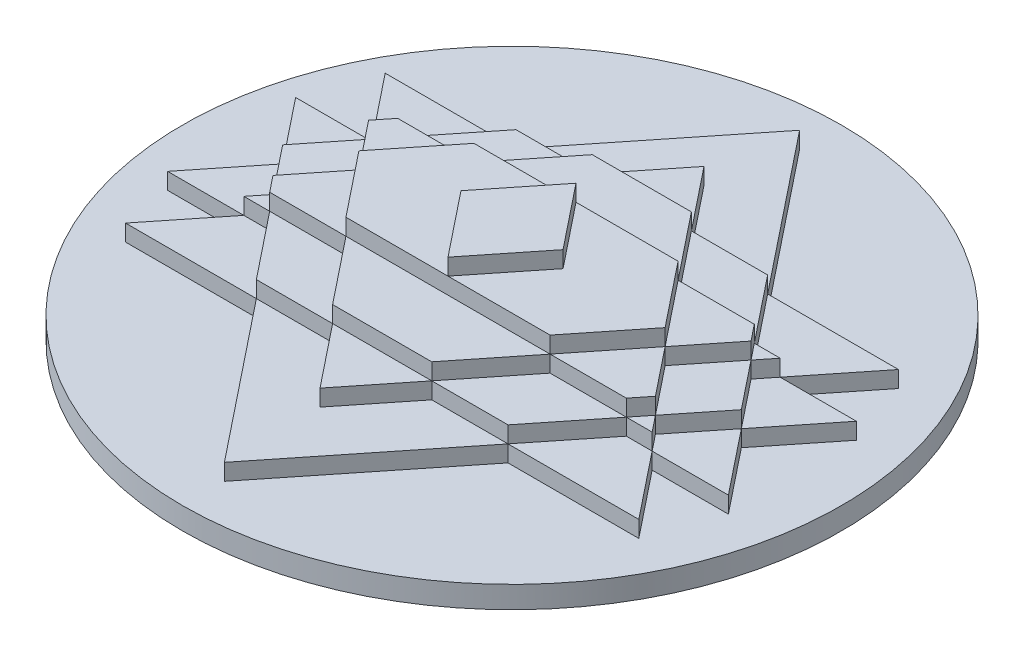
from build123d import *

# Parameters (mm, degrees)
SKETCH1_R            = 300
BOSS_EXTRUDE1_DEPTH  = 10
SKETCH2_R            = 300
BOSS_EXTRUDE2_DEPTH  = 10
BOSS_EXTRUDE4_DEPTH  = 15
BOSS_EXTRUDE5_DEPTH  = 15
BOSS_EXTRUDE11_DEPTH = 15
BOSS_EXTRUDE12_DEPTH = 15
BOSS_EXTRUDE13_DEPTH = 15


with BuildPart() as part:
    # Sketch1 → Boss-Extrude1 (new body)
    with BuildSketch(Plane(origin=(0, 0, 0), x_dir=(1, 0, 0), z_dir=(0, 1, 0))):
        with Locations(Location((0, 0, 0), (0, 0, 270))):
            Circle(SKETCH1_R)
    extrude(amount=-BOSS_EXTRUDE1_DEPTH)

    # Sketch2 → Boss-Extrude2 (add)
    with BuildSketch(Plane.XZ.offset(10)):
        with Locations(Location((0, 0, 0), (0, 0, 90))):
            Circle(SKETCH2_R)
    extrude(amount=BOSS_EXTRUDE2_DEPTH)

    # Sketch3 → Boss-Extrude4 (add)
    with BuildSketch(Plane(origin=(0, 0, 0), x_dir=(1, 0, 0), z_dir=(0, 1, 0))):
        Polygon((-45.133571821, -118.172232568), (-114.539322431, -118.172232568), (0, -261.8), (0, -174.767941529), align=None)
        Polygon((0, -174.767941529), (0, -261.8), (114.539322431, -118.172232568), (45.133571821, -118.172232568), align=None)
        Polygon((233.611993377, -118.172232568), (185.830376799, -58.25598051), (162.32093901, -58.25598051), (114.539322431, -118.172232568), align=None)
        Polygon((255.236127409, -58.25598051), (208.778533209, 0), (174.075657904, -43.516029235), (185.830376799, -58.25598051), align=None)
        Polygon((255.236127409, 58.25598051), (185.830376799, 58.25598051), (174.075657904, 43.516029235), (208.778533209, 0), align=None)
        Polygon((233.611993377, 118.172232568), (114.539322431, 118.172232568), (162.32093901, 58.25598051), (185.830376799, 58.25598051), align=None)
        Polygon((114.539322431, 118.172232568), (0, 261.8), (0, 174.767941529), (45.133571821, 118.172232568), align=None)
        Polygon((0, 174.767941529), (0, 261.8), (-114.539322431, 118.172232568), (-45.133571821, 118.172232568), align=None)
        Polygon((-162.32093901, 58.25598051), (-114.539322431, 118.172232568), (-233.611993377, 118.172232568), (-185.830376799, 58.25598051), align=None)
        Polygon((-174.075657904, 43.516029235), (-185.830376799, 58.25598051), (-255.236127409, 58.25598051), (-208.778533209, 0), align=None)
        Polygon((-174.075657904, -43.516029235), (-208.778533209, 0), (-255.236127409, -58.25598051), (-185.830376799, -58.25598051), align=None)
        Polygon((-162.32093901, -58.25598051), (-185.830376799, -58.25598051), (-233.611993377, -118.172232568), (-114.539322431, -118.172232568), align=None)
        Polygon((-174.075657904, 43.516029235), (-162.32093901, 58.25598051), (-185.830376799, 58.25598051), align=None)
        Polygon((-139.372782599, 0), (-174.075657904, 43.516029235), (-208.778533209, 0), (-174.075657904, -43.516029235), align=None)
        Polygon((-162.32093901, -58.25598051), (-174.075657904, -43.516029235), (-185.830376799, -58.25598051), align=None)
        Polygon((-92.9151884, -58.25598051), (-139.372782599, 0), (-174.075657904, -43.516029235), (-162.32093901, -58.25598051), align=None)
        Polygon((-45.133571821, -118.172232568), (-92.9151884, -58.25598051), (-162.32093901, -58.25598051), (-114.539322431, -118.172232568), align=None)
        Polygon((0, -174.767941529), (0, -118.172232568), (-45.133571821, -118.172232568), align=None)
        Polygon((45.133571821, -118.172232568), (0, -118.172232568), (0, -174.767941529), align=None)
        Polygon((162.32093901, -58.25598051), (92.9151884, -58.25598051), (45.133571821, -118.172232568), (114.539322431, -118.172232568), align=None)
        Polygon((174.075657904, -43.516029235), (139.372782599, 0), (92.9151884, -58.25598051), (162.32093901, -58.25598051), align=None)
        Polygon((185.830376799, -58.25598051), (174.075657904, -43.516029235), (162.32093901, -58.25598051), align=None)
        Polygon((208.778533209, 0), (174.075657904, 43.516029235), (139.372782599, 0), (174.075657904, -43.516029235), align=None)
        Polygon((174.075657904, 43.516029235), (162.32093901, 58.25598051), (92.9151884, 58.25598051), (139.372782599, 0), align=None)
        Polygon((185.830376799, 58.25598051), (162.32093901, 58.25598051), (174.075657904, 43.516029235), align=None)
        Polygon((162.32093901, 58.25598051), (114.539322431, 118.172232568), (45.133571821, 118.172232568), (92.9151884, 58.25598051), align=None)
        Polygon((45.133571821, 118.172232568), (0, 174.767941529), (0, 118.172232568), align=None)
        Polygon((0, 118.172232568), (0, 174.767941529), (-45.133571821, 118.172232568), align=None)
        Polygon((-45.133571821, 118.172232568), (-114.539322431, 118.172232568), (-162.32093901, 58.25598051), (-92.9151884, 58.25598051), align=None)
        Polygon((-92.9151884, 58.25598051), (-162.32093901, 58.25598051), (-174.075657904, 43.516029235), (-139.372782599, 0), align=None)
        Polygon((-46.4575942, 0), (-92.9151884, 58.25598051), (-139.372782599, 0), (-92.9151884, -58.25598051), align=None)
        Polygon((-46.4575942, 0), (0, 58.25598051), (-92.9151884, 58.25598051), align=None)
        Polygon((0, 58.25598051), (0, 118.172232568), (-45.133571821, 118.172232568), (-92.9151884, 58.25598051), align=None)
        Polygon((45.133571821, 118.172232568), (0, 118.172232568), (0, 58.25598051), (92.9151884, 58.25598051), align=None)
        Polygon((92.9151884, 58.25598051), (0, 58.25598051), (46.4575942, 0), align=None)
        Polygon((139.372782599, 0), (92.9151884, 58.25598051), (46.4575942, 0), (92.9151884, -58.25598051), align=None)
        Polygon((92.9151884, -58.25598051), (46.4575942, 0), (0, -58.25598051), align=None)
        Polygon((46.4575942, 0), (0, 0), (0, -58.25598051), align=None)
        Polygon((46.4575942, 0), (0, 58.25598051), (0, 0), align=None)
        Polygon((0, 0), (0, 58.25598051), (-46.4575942, 0), align=None)
        Polygon((0, -58.25598051), (0, 0), (-46.4575942, 0), align=None)
        Polygon((0, -58.25598051), (-46.4575942, 0), (-92.9151884, -58.25598051), align=None)
        Polygon((0, -118.172232568), (0, -58.25598051), (-92.9151884, -58.25598051), (-45.133571821, -118.172232568), align=None)
        Polygon((92.9151884, -58.25598051), (0, -58.25598051), (0, -118.172232568), (45.133571821, -118.172232568), align=None)
    extrude(amount=BOSS_EXTRUDE4_DEPTH)

    # Sketch4 → Boss-Extrude5 (add)
    with BuildSketch(Plane(origin=(0, 15, 0), x_dir=(1, 0, 0), z_dir=(0, 1, 0))):
        Polygon((45.133571821, 118.172232568), (0, 174.767941529), (-45.133571821, 118.172232568), (-114.539322431, 118.172232568), (-162.32093901, 58.25598051), (-185.830376799, 58.25598051), (-174.075657904, 43.516029235), (-208.778533209, 0), (-174.075657904, -43.516029235), (-185.830376799, -58.25598051), (-162.32093901, -58.25598051), (-114.539322431, -118.172232568), (-45.133571821, -118.172232568), (0, -174.767941529), (45.133571821, -118.172232568), (114.539322431, -118.172232568), (162.32093901, -58.25598051), (185.830376799, -58.25598051), (174.075657904, -43.516029235), (208.778533209, 0), (174.075657904, 43.516029235), (185.830376799, 58.25598051), (162.32093901, 58.25598051), (114.539322431, 118.172232568), align=None)
    extrude(amount=BOSS_EXTRUDE5_DEPTH)

    # Sketch6 → Boss-Extrude11 (add)
    with BuildSketch(Plane(origin=(0, 30, 0), x_dir=(1, 0, 0), z_dir=(0, 1, 0))):
        Polygon((0, -118.172232568), (0, -58.25598051), (-92.9151884, -58.25598051), (-45.133571821, -118.172232568), align=None)
        Polygon((92.9151884, -58.25598051), (0, -58.25598051), (0, -118.172232568), (45.133571821, -118.172232568), align=None)
        Polygon((174.075657904, -43.516029235), (139.372782599, 0), (92.9151884, -58.25598051), (162.32093901, -58.25598051), align=None)
        Polygon((139.372782599, 0), (92.9151884, 58.25598051), (46.4575942, 0), (92.9151884, -58.25598051), align=None)
        Polygon((174.075657904, 43.516029235), (162.32093901, 58.25598051), (92.9151884, 58.25598051), (139.372782599, 0), align=None)
        Polygon((45.133571821, 118.172232568), (0, 118.172232568), (0, 58.25598051), (92.9151884, 58.25598051), align=None)
        Polygon((0, 58.25598051), (0, 118.172232568), (-45.133571821, 118.172232568), (-92.9151884, 58.25598051), align=None)
        Polygon((-46.4575942, 0), (-92.9151884, 58.25598051), (-139.372782599, 0), (-92.9151884, -58.25598051), align=None)
        Polygon((-92.9151884, 58.25598051), (-162.32093901, 58.25598051), (-174.075657904, 43.516029235), (-139.372782599, 0), align=None)
        Polygon((-92.9151884, -58.25598051), (-139.372782599, 0), (-174.075657904, -43.516029235), (-162.32093901, -58.25598051), align=None)
        Polygon((0, -58.25598051), (-46.4575942, 0), (-92.9151884, -58.25598051), align=None)
        Polygon((92.9151884, -58.25598051), (46.4575942, 0), (0, -58.25598051), align=None)
        Polygon((46.4575942, 0), (0, 0), (0, -58.25598051), align=None)
        Polygon((0, -58.25598051), (0, 0), (-46.4575942, 0), align=None)
        Polygon((0, 0), (0, 58.25598051), (-46.4575942, 0), align=None)
        Polygon((46.4575942, 0), (0, 58.25598051), (0, 0), align=None)
        Polygon((92.9151884, 58.25598051), (0, 58.25598051), (46.4575942, 0), align=None)
        Polygon((-46.4575942, 0), (0, 58.25598051), (-92.9151884, 58.25598051), align=None)
    extrude(amount=BOSS_EXTRUDE11_DEPTH)

    # Sketch10 → Boss-Extrude12 (add)
    with BuildSketch(Plane(origin=(0, 45, 0), x_dir=(1, 0, 0), z_dir=(0, 1, 0))):
        Polygon((-46.4575942, 0), (-92.9151884, 58.25598051), (-139.372782599, 0), (-92.9151884, -58.25598051), align=None)
        Polygon((-46.4575942, 0), (0, 58.25598051), (-92.9151884, 58.25598051), align=None)
        Polygon((92.9151884, 58.25598051), (0, 58.25598051), (46.4575942, 0), align=None)
        Polygon((139.372782599, 0), (92.9151884, 58.25598051), (46.4575942, 0), (92.9151884, -58.25598051), align=None)
        Polygon((92.9151884, -58.25598051), (46.4575942, 0), (0, -58.25598051), align=None)
        Polygon((46.4575942, 0), (0, 58.25598051), (0, 0), align=None)
        Polygon((0, 0), (0, 58.25598051), (-46.4575942, 0), align=None)
        Polygon((0, -58.25598051), (0, 0), (-46.4575942, 0), align=None)
        Polygon((46.4575942, 0), (0, 0), (0, -58.25598051), align=None)
        Polygon((0, -58.25598051), (-46.4575942, 0), (-92.9151884, -58.25598051), align=None)
    extrude(amount=BOSS_EXTRUDE12_DEPTH)

    # Sketch11 → Boss-Extrude13 (add)
    with BuildSketch(Plane(origin=(0, 60, 0), x_dir=(1, 0, 0), z_dir=(0, 1, 0))):
        Polygon((0, 0), (0, 58.25598051), (-46.4575942, 0), align=None)
        Polygon((46.4575942, 0), (0, 58.25598051), (0, 0), align=None)
        Polygon((46.4575942, 0), (0, 0), (0, -58.25598051), align=None)
        Polygon((0, -58.25598051), (0, 0), (-46.4575942, 0), align=None)
    extrude(amount=BOSS_EXTRUDE13_DEPTH)


solid = part.part
